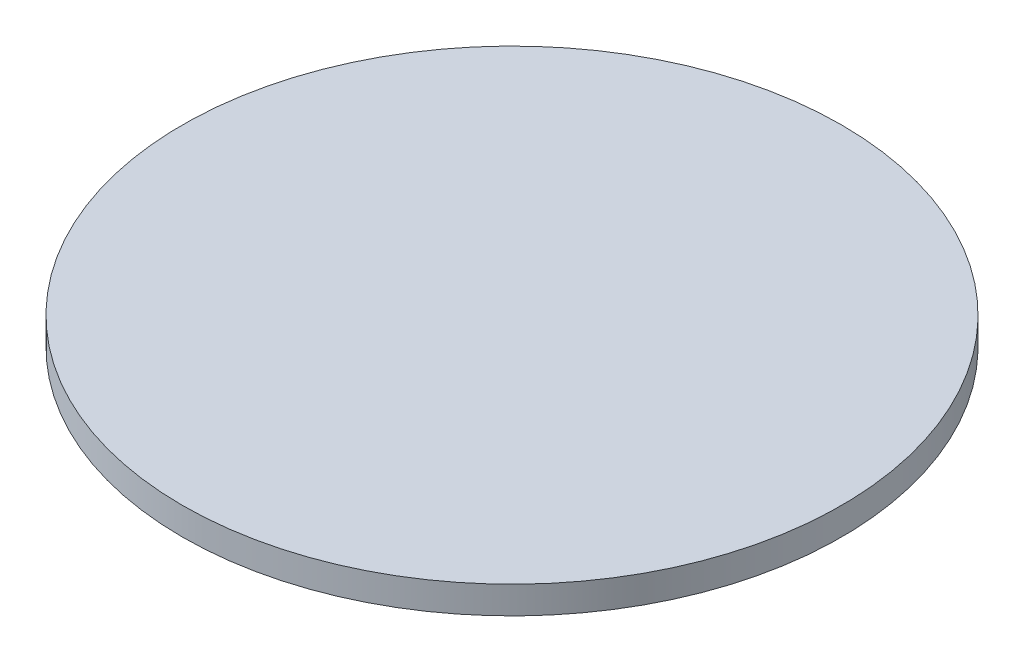
from build123d import *

# Parameters (mm, degrees)
SKETCH1_R      = 152.4
EXTRUDE1_DEPTH = 12.7


with BuildPart() as part:
    # Sketch1 → Extrude1 (new body)
    with BuildSketch(Plane(origin=(0, 0, 0), x_dir=(1, 0, 0), z_dir=(0, 1, 0))):
        with Locations(Location((0, 0, 0), (0, 0, 270))):
            Circle(SKETCH1_R)
    extrude(amount=EXTRUDE1_DEPTH)


solid = part.part
